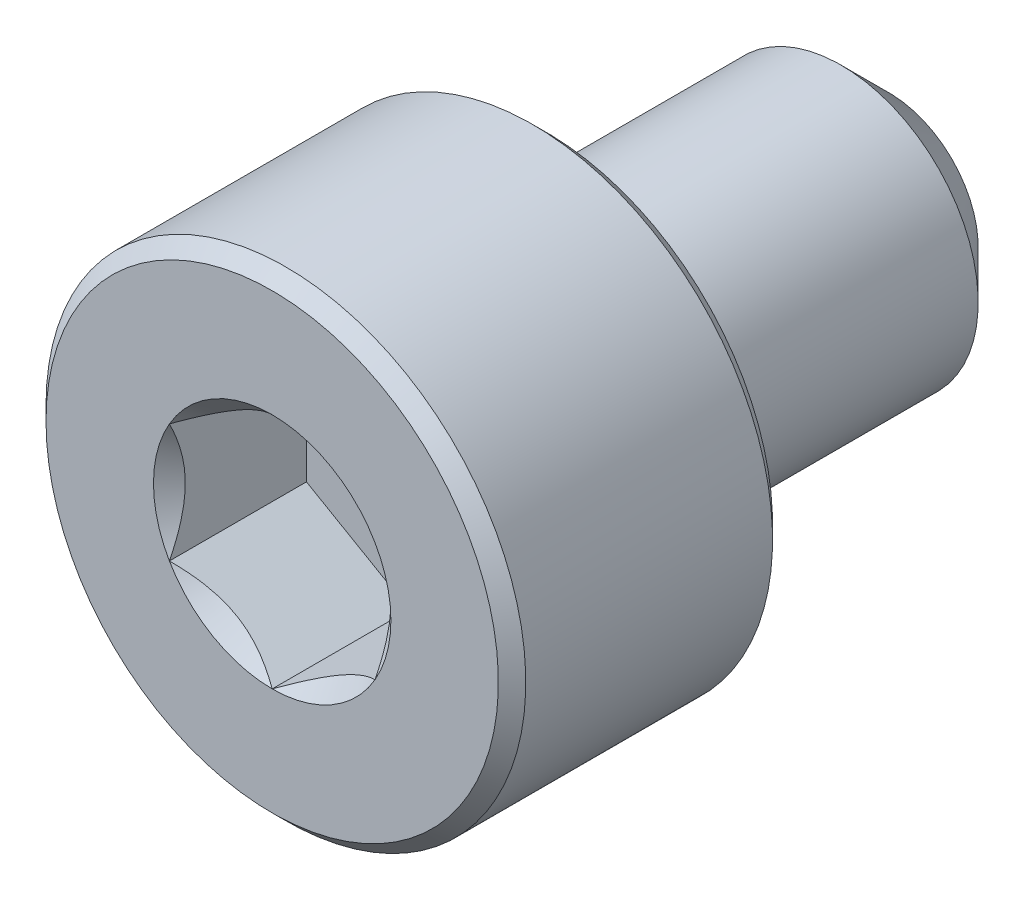
from build123d import *

# Parameters (mm, degrees)
CUT_EXTRUDE1_START = -2
CUT_EXTRUDE1_DEPTH = 2
SKETCH4_R          = 1.732050808
CUT_EXTRUDE2_DEPTH = 0.5
CUT_EXTRUDE2_DRAFT = -45


with BuildPart() as part:
    # Sketch2 → Revolve1 (revolve)
    with BuildSketch(Plane(origin=(0, 0, 0), x_dir=(0, 0, -1), z_dir=(1, 0, 0)), mode=Mode.PRIVATE) as revolve1_sk:
        Polygon((-4.3, 3.5), (-0.7, 3.5), (-0.5, 3.3), (-0.5, 2), (3.8, 2), (4.5, 1.3), (4.5, 0), (-4.5, 0), (-4.5, 3.3), align=None)
    revolve(revolve1_sk.sketch.rotate(Axis((0, 0, -4.5), (0, 0, 1)), 90), axis=Axis((0, 0, -4.5), (0, 0, 1)))

    # Sketch3 → Cut-Extrude1 (cut)
    with BuildSketch(Plane.XY.offset(4.5).offset(CUT_EXTRUDE1_START)):
        Polygon((0, 1.732050808), (-1.5, 0.866025404), (-1.5, -0.866025404), (0, -1.732050808), (1.5, -0.866025404), (1.5, 0.866025404), align=None)
    extrude(amount=CUT_EXTRUDE1_DEPTH, mode=Mode.SUBTRACT)


with BuildPart() as cut_extrude2_tool:
    # Sketch4 → Cut-Extrude2 (with draft: the straight prism first)
    with BuildSketch(Plane.XY.offset(4.5)):
        Circle(SKETCH4_R)
    extrude(amount=-CUT_EXTRUDE2_DEPTH)
    # Cut-Extrude2: the draft: its side faces are tilted about the plane it starts from
    cut_extrude2_sides = [cut_extrude2_tool.faces().sort_by_distance(p)[0] for p in [
        (-1.732050808, 0, 4.25),
    ]]
    draft(cut_extrude2_sides, Plane.XY.offset(4.5), CUT_EXTRUDE2_DRAFT)


with BuildPart() as part_1:
    add(part.part)

    # Cut-Extrude2: cut by cut_extrude2_tool
    add(cut_extrude2_tool.part, mode=Mode.SUBTRACT)


solid = part_1.part
